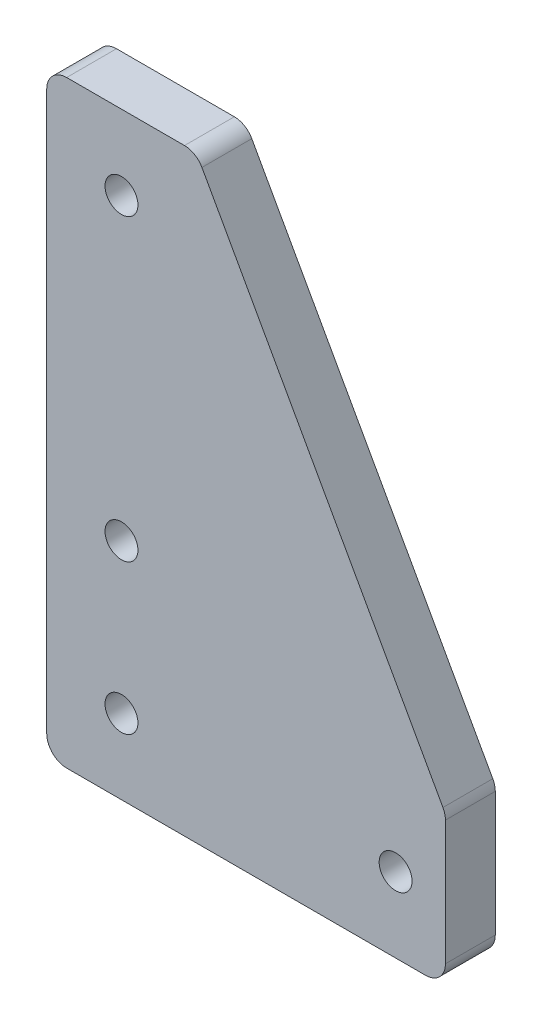
from build123d import *

# Parameters (mm, degrees)
SKETCH_1_R      = 1.65
EXTRUDE_1_DEPTH = 5
FILLET_1_R      = 2


with BuildPart() as part:
    # ｽｹｯﾁ1 → ﾎﾞｽ - 押し出し1 (new body)
    with BuildSketch(Plane.XY):
        Polygon((0, 0), (40, 0), (40, 15), (15, 60), (0, 60), align=None)
        with Locations((35, 7.5)):
            Circle(SKETCH_1_R, mode=Mode.SUBTRACT)
        with Locations((7.5, 7.5)):
            Circle(SKETCH_1_R, mode=Mode.SUBTRACT)
        with Locations((7.5, 22.5)):
            Circle(SKETCH_1_R, mode=Mode.SUBTRACT)
        with Locations((7.5, 52.5)):
            Circle(SKETCH_1_R, mode=Mode.SUBTRACT)
    extrude(amount=EXTRUDE_1_DEPTH)

    # ﾌｨﾚｯﾄ1
    fillet_1_edges = [part.edges().sort_by_distance(p)[0] for p in [
        (0, 60, 2.5),
        (15, 60, 2.5),
        (40, 15, 2.5),
        (40, 0, 2.5),
        (0, 0, 2.5),
    ]]
    fillet(fillet_1_edges, radius=FILLET_1_R)


solid = part.part
